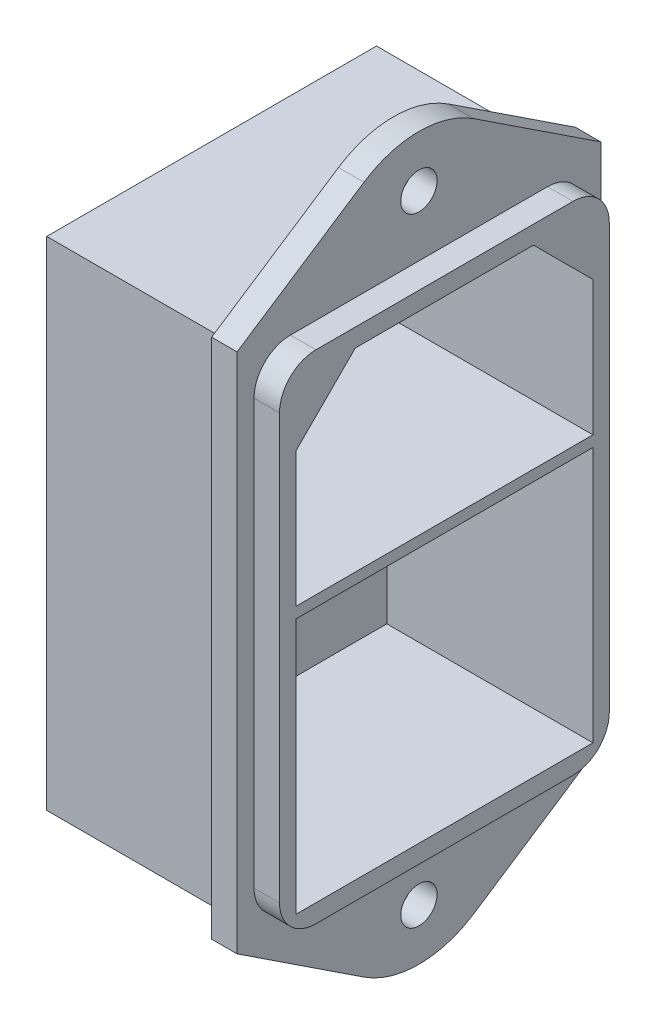
from build123d import *

# Parameters (mm, degrees)
SKETCH1_R           = 1.5
SKETCH1_W           = 30
SKETCH1_H           = 43
SKETCH1_W_2         = 27.2
SKETCH1_H_2         = 41
SKETCH1_W_3         = 24.5
SKETCH1_H_3         = 21.1
BOSS_EXTRUDE1_DEPTH = 2.1
BOSS_EXTRUDE2_START = 2.1
SKETCH1_3_W         = 27.2
SKETCH1_3_H         = 41
SKETCH1_3_W_2       = 24.5
SKETCH1_3_H_2       = 21.1
BOSS_EXTRUDE2_DEPTH = 2.1
FILLET1_R           = 3
SKETCH1_4_W         = 27.2
SKETCH1_4_H         = 41
SKETCH1_4_W_2       = 24.5
SKETCH1_4_H_2       = 21.1
BOSS_EXTRUDE3_DEPTH = 15
BOSS_EXTRUDE4_START = -15
SKETCH1_5_W         = 24.5
SKETCH1_5_H         = 21.1
BOSS_EXTRUDE4_DEPTH = 2.2


with BuildPart() as part:
    # Sketch1 → Boss-Extrude1 (new body)
    # profile 1 of 4: a face of its own
    with BuildSketch(Plane(origin=(0, 0, 0), x_dir=(0, 0, -1), z_dir=(1, 0, 0))):
        with BuildLine():
            ThreePointArc((-4.5375, 28.390108399), (0, 29.75), (4.5375, 28.390108399))
            Line((4.5375, 28.390108399), (15, 21.5))
            Line((15, 21.5), (-15, 21.5))
            Line((-15, 21.5), (-4.5375, 28.390108399))
        make_face()
        with Locations((0, 25.5)):
            Circle(SKETCH1_R, mode=Mode.SUBTRACT)
    # profile 2 of 4: a face of its own
    with BuildSketch(Plane(origin=(0, 0, 0), x_dir=(0, 0, -1), z_dir=(1, 0, 0))):
        Rectangle(SKETCH1_W, SKETCH1_H)
        Rectangle(SKETCH1_W_2, SKETCH1_H_2, mode=Mode.SUBTRACT)
    # profile 3 of 4: a face of its own
    with BuildSketch(Plane(origin=(0, 0, 0), x_dir=(0, 0, -1), z_dir=(1, 0, 0))):
        Rectangle(SKETCH1_W_2, SKETCH1_H_2)
        Polygon((-12.25, 14.1), (-12.25, 3), (12.25, 3), (12.25, 14.1), (7.35, 19), (-7.35, 19), align=None, mode=Mode.SUBTRACT)
        with Locations((0, -8.45)):
            Rectangle(SKETCH1_W_3, SKETCH1_H_3, mode=Mode.SUBTRACT)
    # profile 4 of 4: a face of its own
    with BuildSketch(Plane(origin=(0, 0, 0), x_dir=(0, 0, -1), z_dir=(1, 0, 0))):
        with BuildLine():
            Line((-15, -21.5), (-4.5375, -28.390108399))
            ThreePointArc((-4.5375, -28.390108399), (0, -29.75), (4.5375, -28.390108399))
            Line((4.5375, -28.390108399), (15, -21.5))
            Line((15, -21.5), (-15, -21.5))
        make_face()
        with Locations((0, -25.5)):
            Circle(SKETCH1_R, mode=Mode.SUBTRACT)
    extrude(amount=BOSS_EXTRUDE1_DEPTH)

    # Sketch1<3> → Boss-Extrude2 (add)
    with BuildSketch(Plane(origin=(0, 0, 0), x_dir=(0, 0, -1), z_dir=(1, 0, 0)).offset(BOSS_EXTRUDE2_START)):
        Rectangle(SKETCH1_3_W, SKETCH1_3_H)
        Polygon((-12.25, 14.1), (-12.25, 3), (12.25, 3), (12.25, 14.1), (7.35, 19), (-7.35, 19), align=None, mode=Mode.SUBTRACT)
        with Locations((0, -8.45)):
            Rectangle(SKETCH1_3_W_2, SKETCH1_3_H_2, mode=Mode.SUBTRACT)
    extrude(amount=BOSS_EXTRUDE2_DEPTH)

    # Fillet1
    fillet1_edges = [part.edges().sort_by_distance(p)[0] for p in [
        (3.15, -20.5, 13.6),
        (3.15, -20.5, -13.6),
        (3.15, 20.5, -13.6),
        (3.15, 20.5, 13.6),
    ]]
    fillet(fillet1_edges, radius=FILLET1_R)

    # Sketch1<4> → Boss-Extrude3 (add)
    with BuildSketch(Plane(origin=(0, 0, 0), x_dir=(0, 0, -1), z_dir=(1, 0, 0))):
        Rectangle(SKETCH1_4_W, SKETCH1_4_H)
        Polygon((-12.25, 14.1), (-12.25, 3), (12.25, 3), (12.25, 14.1), (7.35, 19), (-7.35, 19), align=None, mode=Mode.SUBTRACT)
        with Locations((0, -8.45)):
            Rectangle(SKETCH1_4_W_2, SKETCH1_4_H_2, mode=Mode.SUBTRACT)
    extrude(amount=-BOSS_EXTRUDE3_DEPTH)

    # Sketch1<5> → Boss-Extrude4 (add)
    with BuildSketch(Plane(origin=(0, 0, 0), x_dir=(0, 0, -1), z_dir=(1, 0, 0)).offset(BOSS_EXTRUDE4_START)):
        Polygon((-7.35, 19), (-12.25, 14.1), (-12.25, 3), (12.25, 3), (12.25, 14.1), (7.35, 19), align=None)
        with Locations((0, -8.45)):
            Rectangle(SKETCH1_5_W, SKETCH1_5_H)
    extrude(amount=BOSS_EXTRUDE4_DEPTH)


solid = part.part
